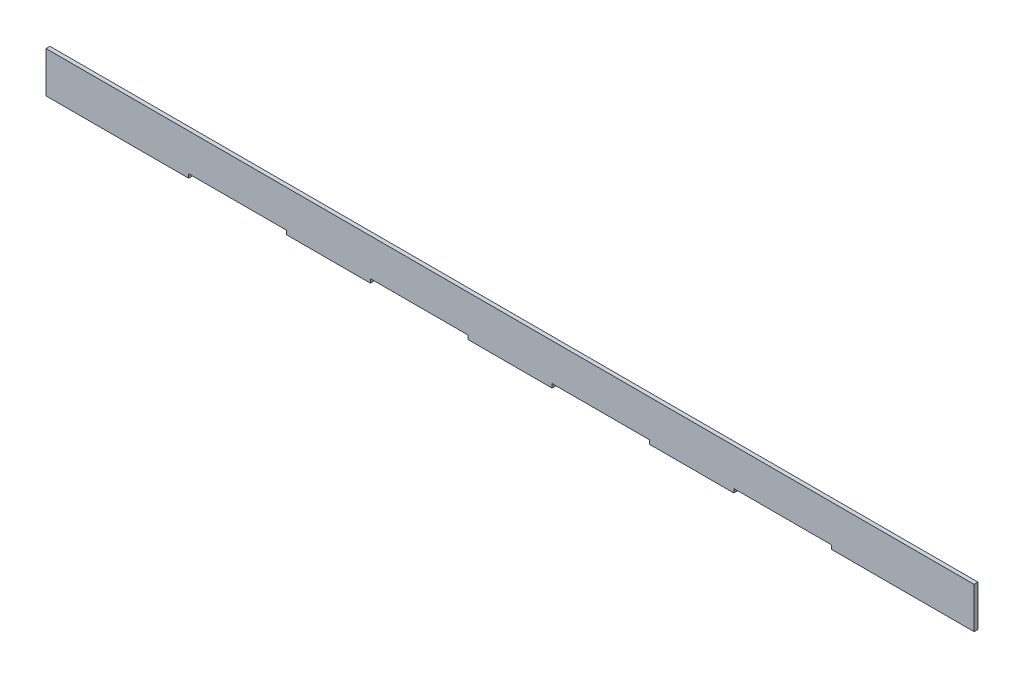
from build123d import *

# Parameters (mm, degrees)
SKETCH1_W           = 475
SKETCH1_H           = 21
BOSS_EXTRUDE1_DEPTH = 2
SKETCH2_W           = 50
SKETCH2_H           = 2
CUT_EXTRUDE1_DEPTH  = 2


with BuildPart() as part:
    # Sketch1 → Boss-Extrude1 (new body)
    with BuildSketch(Plane.XY):
        Rectangle(SKETCH1_W, SKETCH1_H)
    extrude(amount=BOSS_EXTRUDE1_DEPTH)

    # Sketch2 → Cut-Extrude1 (cut)
    with BuildSketch(Plane.XY.offset(2)):
        with Locations((-46.5, -9.5)):
            Rectangle(SKETCH2_W, SKETCH2_H)
        with Locations((-139.5, -9.5)):
            Rectangle(SKETCH2_W, SKETCH2_H)
        with Locations((46.5, -9.5)):
            Rectangle(SKETCH2_W, SKETCH2_H)
        with Locations((139.5, -9.5)):
            Rectangle(SKETCH2_W, SKETCH2_H)
    extrude(amount=-CUT_EXTRUDE1_DEPTH, mode=Mode.SUBTRACT)


solid = part.part
